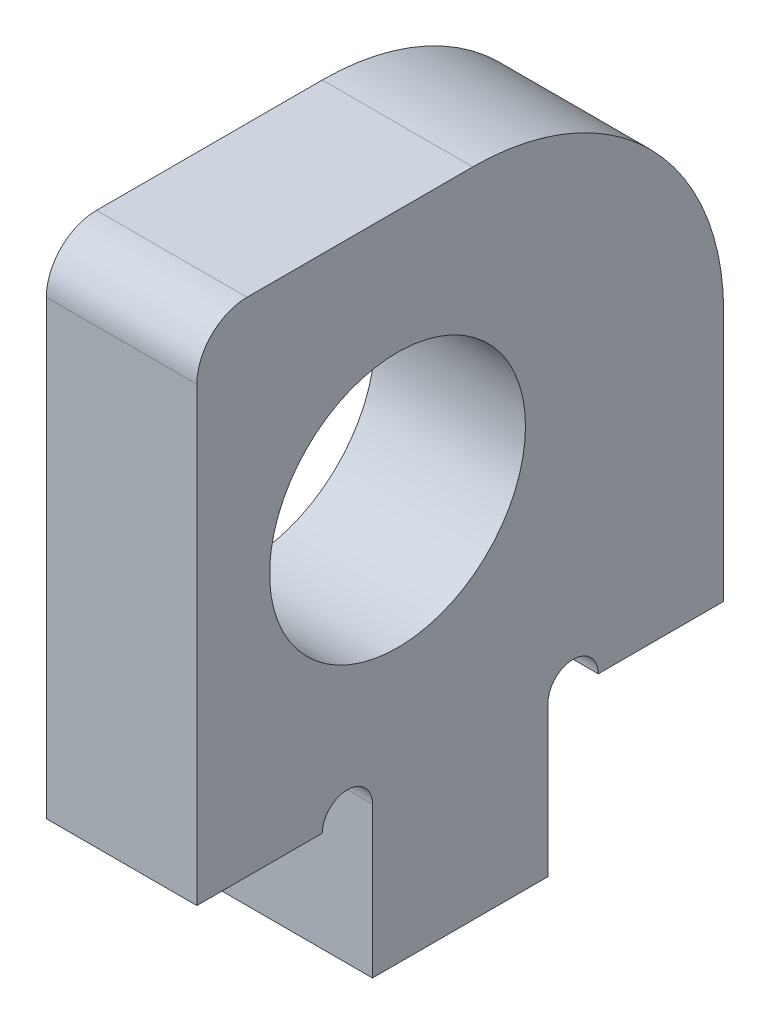
from build123d import *

# Parameters (mm, degrees)
SKETCH_1_W          = 21
SKETCH_1_H          = 20
SKETCH_1_R          = 5.1
EXTRUDE_1_DEPTH     = 6
FILLET_1_R          = 10
FILLET_2_R          = 2
SKETCH_2_W          = 7
SKETCH_2_H          = 6
EXTRUDE_2_DEPTH     = 6
SKETCH_3_R          = 1
CUT_EXTRUDE_1_DEPTH = 10


with BuildPart() as part:
    # 스케치1 → 보스-돌출1 (new body)
    with BuildSketch(Plane(origin=(0, 0, 0), x_dir=(0, 0, -1), z_dir=(1, 0, 0))):
        with Locations((10.5, 10)):
            Rectangle(SKETCH_1_W, SKETCH_1_H)
        with Locations((8, 10)):
            Circle(SKETCH_1_R, mode=Mode.SUBTRACT)
    extrude(amount=EXTRUDE_1_DEPTH)

    # 필렛1
    fillet_1_edges = [part.edges().sort_by_distance(p)[0] for p in [
        (3, 20, -21),
    ]]
    fillet(fillet_1_edges, radius=FILLET_1_R)

    # 필렛2
    fillet_2_edges = [part.edges().sort_by_distance(p)[0] for p in [
        (3, 20, 0),
    ]]
    fillet(fillet_2_edges, radius=FILLET_2_R)

    # 스케치2 → 보스-돌출2 (add)
    with BuildSketch(Plane(origin=(6, 0, 0), x_dir=(0, 0, -1), z_dir=(1, 0, 0))):
        with Locations((10.5, -3)):
            Rectangle(SKETCH_2_W, SKETCH_2_H)
    extrude(amount=-EXTRUDE_2_DEPTH)

    # 스케치3 → 컷-돌출1 (cut)
    with BuildSketch(Plane(origin=(6, 0, 0), x_dir=(0, 0, -1), z_dir=(1, 0, 0))):
        with Locations((15, 0)):
            Circle(SKETCH_3_R)
        with Locations((6, 0)):
            Circle(SKETCH_3_R)
    extrude(amount=-CUT_EXTRUDE_1_DEPTH, mode=Mode.SUBTRACT)


solid = part.part
